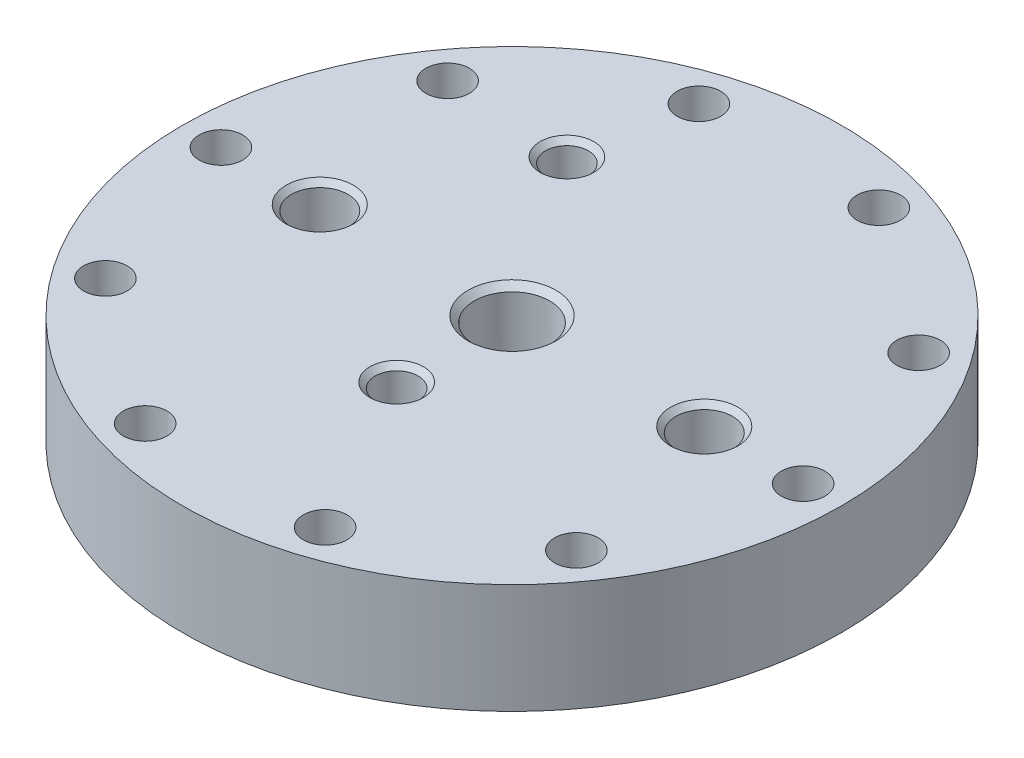
from build123d import *

# Parameters (mm, degrees)
F_3_4_16_TAPPED_HOLE1_D            = 17.4625
F_3_4_16_TAPPED_HOLE1_CSINK_D      = 20.32
F_3_4_16_TAPPED_HOLE1_CSINK_ANGLE  = 90
F_9_16_18_TAPPED_HOLE1_D           = 13.09624
F_9_16_18_TAPPED_HOLE1_CSINK_D     = 15.5575
F_9_16_18_TAPPED_HOLE1_CSINK_ANGLE = 90
F_3_8_CLEARANCE_HOLE2_D            = 10.0838
CIRPATTERN1_COUNT                  = 10
SKETCH15_R                         = 3.175
CUT_EXTRUDE1_DEPTH                 = 12.7
F_7_16_20_TAPPED_HOLE1_D           = 9.92124
F_7_16_20_TAPPED_HOLE1_DEPTH       = 14.799358796
F_7_16_20_TAPPED_HOLE1_CSINK_D     = 12.3825
F_7_16_20_TAPPED_HOLE1_CSINK_ANGLE = 90
F_7_16_20_TAPPED_HOLE1_TIP         = 2.980641204
F_7_16_20_TAPPED_HOLE2_D           = 9.92124
F_7_16_20_TAPPED_HOLE2_CSINK_D     = 12.3825
F_7_16_20_TAPPED_HOLE2_CSINK_ANGLE = 90


with BuildPart() as part:
    # Sketch1 → Revolve1 (revolve)
    with BuildSketch(Plane.XY):
        Polygon((0, 0), (-76.2, 0), (-76.2, -25.4), (-58.8899, -25.4), (-58.8899, -22.7076), (-54.8259, -22.7076), (-54.8259, -25.4), (-36.6649, -25.4), (-36.6649, -22.7076), (-32.6009, -22.7076), (-32.6009, -25.4), (-31.0134, -25.4), (-31.0134, -24.765), (-10.9982, -19.812), (0, -13.462186269), align=None)
    revolve(axis=Axis((0, 0, 0), (0, -1, 0)))

    # 3/4-16 Tapped Hole1 (through all)
    with Locations(Plane(origin=(0, 0, 0), x_dir=(1, 0, 0), z_dir=(0, 1, 0))):
        with Locations((0, 0)):
            CounterSinkHole(F_3_4_16_TAPPED_HOLE1_D / 2, F_3_4_16_TAPPED_HOLE1_CSINK_D / 2, counter_sink_angle=F_3_4_16_TAPPED_HOLE1_CSINK_ANGLE)

    # 9/16-18 Tapped Hole1 (through all)
    with Locations(Plane(origin=(0, 0, 0), x_dir=(1, 0, 0), z_dir=(0, 1, 0))):
        with Locations((-44.45, 0), (44.45, 0)):
            CounterSinkHole(F_9_16_18_TAPPED_HOLE1_D / 2, F_9_16_18_TAPPED_HOLE1_CSINK_D / 2, counter_sink_angle=F_9_16_18_TAPPED_HOLE1_CSINK_ANGLE)

    # 3/8 Clearance Hole2 (through all)
    with Locations(Plane(origin=(67.31, 0, 0), x_dir=(0, 0, 1), z_dir=(0, 1, 0))):
        with Locations((0, 0)):
            f_3_8_clearance_hole2 = Hole(F_3_8_CLEARANCE_HOLE2_D / 2)

    # CirPattern1: 3/8 Clearance Hole2 ×10 about axis
    cirpattern1_axis = Axis((0, 0, 0), (0, 1, 0))
    for i in range(1, CIRPATTERN1_COUNT):
        add(f_3_8_clearance_hole2.rotate(cirpattern1_axis, i * 360 / CIRPATTERN1_COUNT), mode=Mode.SUBTRACT)

    # Sketch15 → Cut-Extrude1 (cut, symmetric)
    with BuildSketch(Plane(origin=(0, -2.71901118, -2.71901118), x_dir=(0, 0.7071067811865489, -0.7071067811865462), z_dir=(0, -0.7071067811865462, -0.7071067811865489))):
        with Locations((-27.975262487, 0)):
            Circle(SKETCH15_R)
    extrude(amount=CUT_EXTRUDE1_DEPTH, both=True, mode=Mode.SUBTRACT)

    # 7/16-20 Tapped Hole1
    with Locations(Plane(origin=(0, 0, 26.67), x_dir=(1, 0, 0), z_dir=(0, 1, 0))):
        with Locations((0, 0)):
            CounterSinkHole(F_7_16_20_TAPPED_HOLE1_D / 2, F_7_16_20_TAPPED_HOLE1_CSINK_D / 2, depth=F_7_16_20_TAPPED_HOLE1_DEPTH, counter_sink_angle=F_7_16_20_TAPPED_HOLE1_CSINK_ANGLE)
            with Locations((0, 0, -(F_7_16_20_TAPPED_HOLE1_DEPTH + F_7_16_20_TAPPED_HOLE1_TIP / 2))):  # 118° drill point
                Cone(0, F_7_16_20_TAPPED_HOLE1_D / 2, F_7_16_20_TAPPED_HOLE1_TIP, mode=Mode.SUBTRACT)

    # 7/16-20 Tapped Hole2 (through all)
    with Locations(Plane(origin=(-25.4, 0, -38.1), x_dir=(0, 0, 1), z_dir=(0, 1, 0))):
        with Locations((0, 0)):
            CounterSinkHole(F_7_16_20_TAPPED_HOLE2_D / 2, F_7_16_20_TAPPED_HOLE2_CSINK_D / 2, counter_sink_angle=F_7_16_20_TAPPED_HOLE2_CSINK_ANGLE)


solid = part.part
